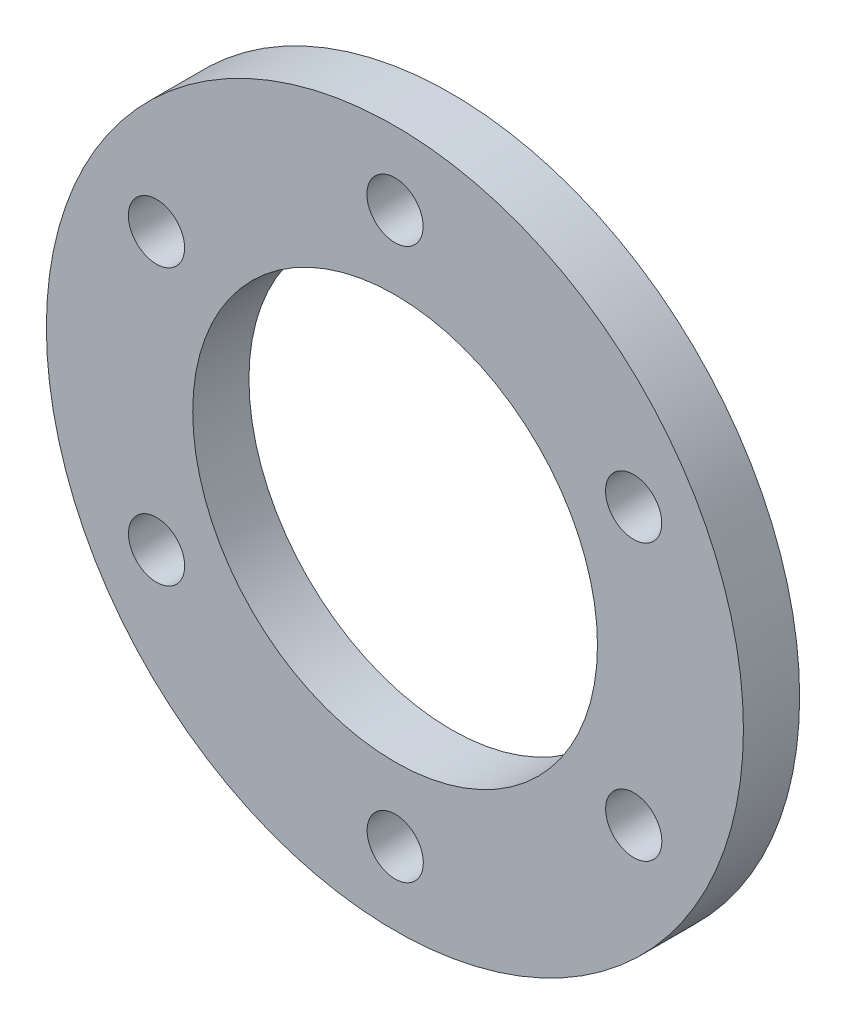
from build123d import *

# Parameters (mm, degrees)
SKETCH1_R           = 31
SKETCH1_R_2         = 18
BOSS_EXTRUDE1_DEPTH = 5
SKETCH2_R           = 2.5
CUT_EXTRUDE1_DEPTH  = 83.445600309


with BuildPart() as part:
    # Sketch1 → Boss-Extrude1 (new body)
    with BuildSketch(Plane.XY):
        with Locations((-36.293764936, 16.369042749)):
            Circle(SKETCH1_R)
        with Locations((-36.275518266, 16.362982128)):
            Circle(SKETCH1_R_2, mode=Mode.SUBTRACT)
    extrude(amount=BOSS_EXTRUDE1_DEPTH)

    # Sketch2 → Cut-Extrude1 (cut, through all)
    with BuildSketch(Plane.XY.offset(5)):
        with Locations((-36.284641601, 40.866012439)):
            Circle(SKETCH2_R)
        with Locations((-15.059833215, 28.622398324)):
            Circle(SKETCH2_R)
        with Locations((-15.050709879, 4.119368013)):
            Circle(SKETCH2_R)
        with Locations((-36.26639493, -8.140048182)):
            Circle(SKETCH2_R)
        with Locations((-57.491203317, 4.103565933)):
            Circle(SKETCH2_R)
        with Locations((-57.500326652, 28.606596243)):
            Circle(SKETCH2_R)
    extrude(amount=-CUT_EXTRUDE1_DEPTH, mode=Mode.SUBTRACT)


solid = part.part
